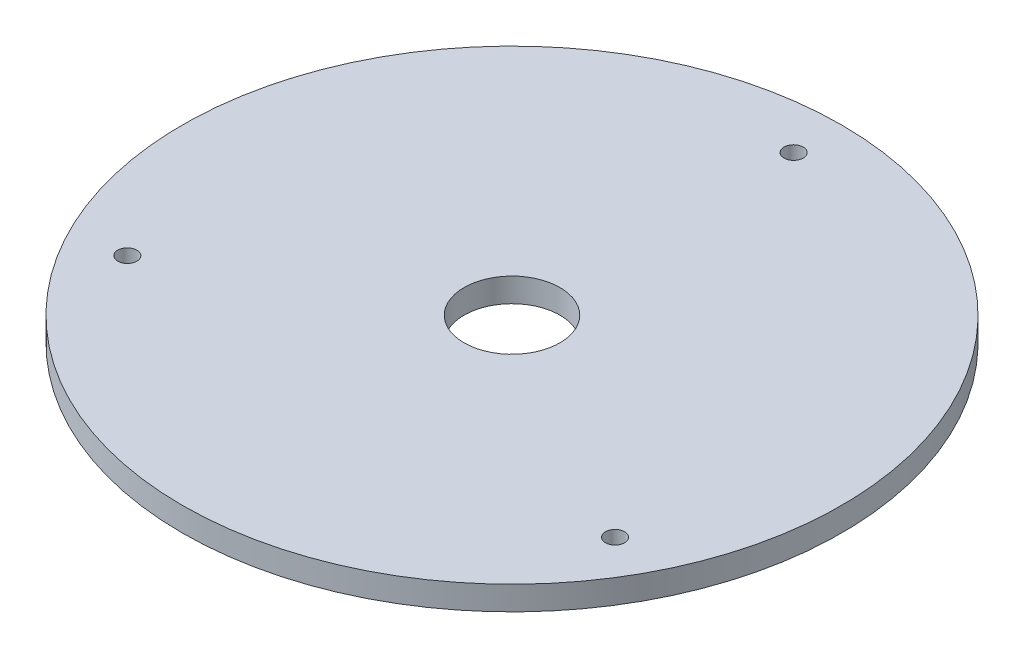
from build123d import *

# Parameters (mm, degrees)
SCHIZZO1_R                   = 55
ESTRUSIONE_ESTRUSIONE1_DEPTH = 4
SCHIZZO2_R                   = 8
SCHIZZO2_R_2                 = 1.6
TAGLIO_ESTRUSIONE1_DEPTH     = 78.884529914


with BuildPart() as part:
    # Schizzo1 → Estrusione-Estrusione1 (new body)
    with BuildSketch(Plane(origin=(0, 0, 0), x_dir=(1, 0, 0), z_dir=(0, 1, 0))):
        with Locations(Location((0, 0, 0), (0, 0, 270))):
            Circle(SCHIZZO1_R)
    extrude(amount=ESTRUSIONE_ESTRUSIONE1_DEPTH)

    # Schizzo2 → Taglio-Estrusione1 (cut, through all)
    with BuildSketch(Plane(origin=(0, 4, 0), x_dir=(1, 0, 0), z_dir=(0, 1, 0))):
        with Locations(Location((0, 0, 0), (0, 0, 270))):
            Circle(SCHIZZO2_R)
        with Locations(Location((0, 47, 0), (0, 0, 270))):
            Circle(SCHIZZO2_R_2)
        with Locations(Location((40.703193978, -23.5, 0), (0, 0, 270))):
            Circle(SCHIZZO2_R_2)
        with Locations(Location((-40.703193978, -23.5, 0), (0, 0, 270))):
            Circle(SCHIZZO2_R_2)
    extrude(amount=-TAGLIO_ESTRUSIONE1_DEPTH, mode=Mode.SUBTRACT)


solid = part.part
